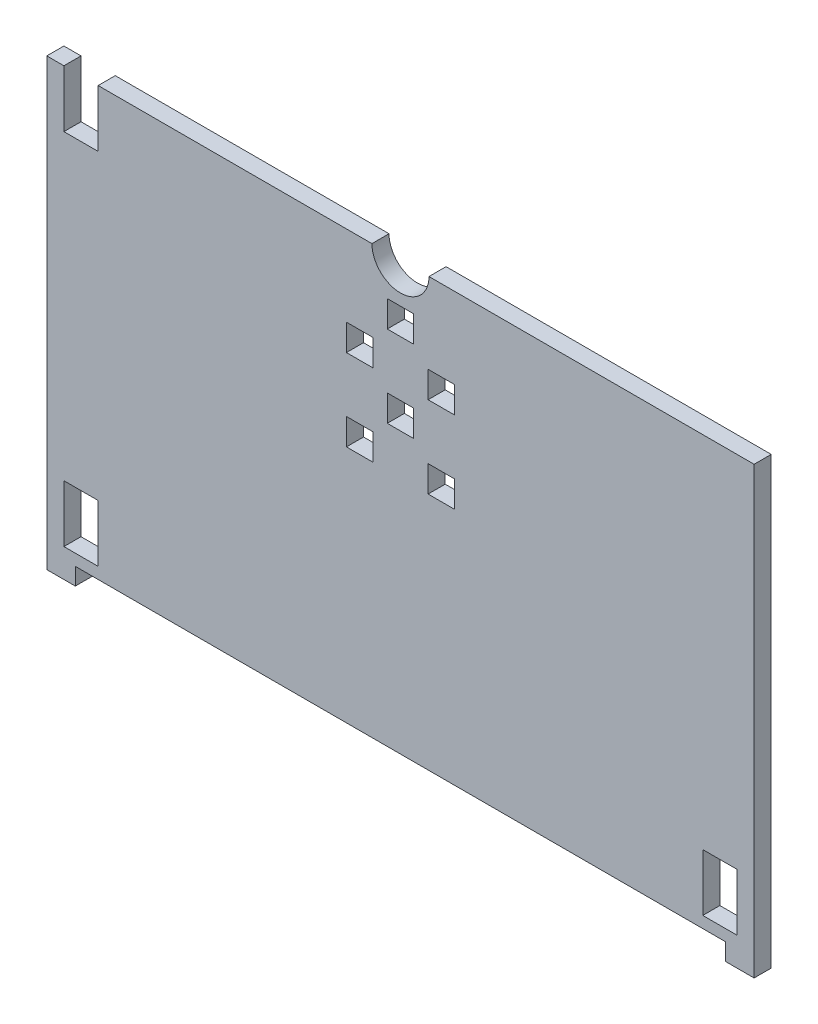
from build123d import *

# Parameters (mm, degrees)
SKETCH1_W           = 6
SKETCH1_H           = 10
BOSS_EXTRUDE1_DEPTH = 3
SKETCH2_W           = 4.62
SKETCH2_H           = 4.62
CUT_EXTRUDE1_DEPTH  = 147.523035732


with BuildPart() as part:
    # Sketch1 → Boss-Extrude1 (new body)
    with BuildSketch(Plane.XY):
        with BuildLine():
            Line((0, 0), (5, 0))
            Line((5, 0), (5, 3))
            Line((5, 3), (119, 3))
            Line((119, 3), (119, 0))
            Line((119, 0), (124, 0))
            Line((124, 0), (124, 78))
            Line((124, 78), (67, 78))
            ThreePointArc((67, 78), (62, 73), (57, 78))
            Line((57, 78), (9, 78))
            Line((9, 78), (9, 68))
            Line((9, 68), (3, 68))
            Line((3, 68), (3, 78))
            Line((3, 78), (0, 78))
            Line((0, 78), (0, 0))
        make_face()
        with Locations((6, 10)):
            Rectangle(SKETCH1_W, SKETCH1_H, mode=Mode.SUBTRACT)
        with Locations((118, 10)):
            Rectangle(SKETCH1_W, SKETCH1_H, mode=Mode.SUBTRACT)
    extrude(amount=BOSS_EXTRUDE1_DEPTH)

    # Sketch2 → Cut-Extrude1 (cut, through all)
    with BuildSketch(Plane.XY.offset(3)):
        with Locations((54.84, 61.53)):
            Rectangle(SKETCH2_W, SKETCH2_H)
        with Locations((69.16, 61.53)):
            Rectangle(SKETCH2_W, SKETCH2_H)
        with Locations((54.84, 47.21)):
            Rectangle(SKETCH2_W, SKETCH2_H)
        with Locations((69.16, 47.21)):
            Rectangle(SKETCH2_W, SKETCH2_H)
        with Locations((62, 54.37)):
            Rectangle(SKETCH2_W, SKETCH2_H)
        with Locations((62, 68.69)):
            Rectangle(SKETCH2_W, SKETCH2_H)
    extrude(amount=-CUT_EXTRUDE1_DEPTH, mode=Mode.SUBTRACT)


solid = part.part
